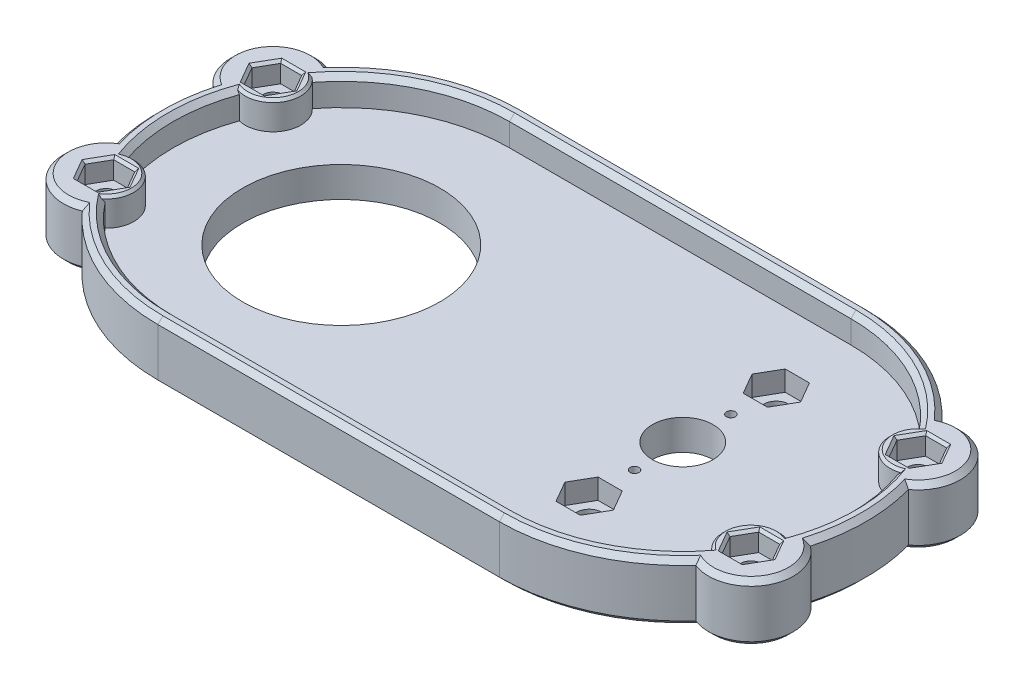
from build123d import *

# Parameters (mm, degrees)
SKETCH1_R               = 19.5
SKETCH1_R_2             = 6
SKETCH1_R_3             = 2.5
SKETCH1_R_4             = 2
BOSS_EXTRUDE1_DEPTH     = 6
SKETCH5_R               = 2
BOSS_EXTRUDE2_DEPTH     = 5.5
CUT_EXTRUDE2_DEPTH      = 4
CHAMFER1_SIZE           = 1
CHAMFER2_SIZE           = 0.5
CUT_EXTRUDE3_DEPTH      = 113.093142074
CUT_EXTRUDE3_DEPTH_BACK = 113.093142074
SKETCH8_R               = 0.875
CUT_EXTRUDE4_DEPTH      = 4


with BuildPart() as part:
    # Sketch1 → Boss-Extrude1 (new body)
    with BuildSketch(Plane(origin=(0, 0, 0), x_dir=(1, 0, 0), z_dir=(0, 1, 0))):
        with BuildLine():
            Line((0, 36.25), (67.5, 36.25))
            ThreePointArc((67.5, 36.25), (82.21405629, 33.129428723), (94.394801605, 24.30498193))
            ThreePointArc((94.394801605, 24.30498193), (104.860213633, 20.548117498), (102.428678881, 9.697932337))
            ThreePointArc((102.428678881, 9.697932337), (103.75, 0), (102.428678881, -9.697932337))
            ThreePointArc((102.428678881, -9.697932337), (104.860213633, -20.548117498), (94.394801605, -24.30498193))
            ThreePointArc((94.394801605, -24.30498193), (82.21405629, -33.129428723), (67.5, -36.25))
            Line((67.5, -36.25), (0, -36.25))
            ThreePointArc((0, -36.25), (-14.71405629, -33.129428723), (-26.894801605, -24.30498193))
            ThreePointArc((-26.894801605, -24.30498193), (-37.360213633, -20.548117498), (-34.928678881, -9.697932337))
            ThreePointArc((-34.928678881, -9.697932337), (-36.25, 0), (-34.928678881, 9.697932337))
            ThreePointArc((-34.928678881, 9.697932337), (-37.360213633, 20.548117498), (-26.894801605, 24.30498193))
            ThreePointArc((-26.894801605, 24.30498193), (-14.71405629, 33.129428723), (0, 36.25))
        make_face()
        with Locations(Location((0, 0, 0), (0, 0, 270))):
            Circle(SKETCH1_R, mode=Mode.SUBTRACT)
        with Locations(Location((67.5, 0, 0), (0, 0, 270))):
            Circle(SKETCH1_R_2, mode=Mode.SUBTRACT)
        with Locations(Location((67.5, 18.5, 0), (0, 0, 270))):
            Circle(SKETCH1_R_3, mode=Mode.SUBTRACT)
        with Locations(Location((67.5, -18.5, 0), (0, 0, 270))):
            Circle(SKETCH1_R_3, mode=Mode.SUBTRACT)
        with Locations(Location((-30, 16.5, 0), (0, 0, 270))):
            Circle(SKETCH1_R_4, mode=Mode.SUBTRACT)
        with Locations(Location((-30, -16.5, 0), (0, 0, 270))):
            Circle(SKETCH1_R_4, mode=Mode.SUBTRACT)
        with Locations(Location((97.5, -16.5, 0), (0, 0, 270))):
            Circle(SKETCH1_R_4, mode=Mode.SUBTRACT)
        with Locations(Location((97.5, 16.5, 0), (0, 0, 270))):
            Circle(SKETCH1_R_4, mode=Mode.SUBTRACT)
    extrude(amount=BOSS_EXTRUDE1_DEPTH)

    # Sketch5 → Boss-Extrude2 (add)
    with BuildSketch(Plane(origin=(0, 6, 0), x_dir=(1, 0, 0), z_dir=(0, 1, 0))):
        with BuildLine():
            Line((0, 36.25), (67.5, 36.25))
            ThreePointArc((67.5, 36.25), (82.21405629, 33.129428723), (94.394801605, 24.30498193))
            ThreePointArc((94.394801605, 24.30498193), (104.860213633, 20.548117498), (102.428678881, 9.697932337))
            ThreePointArc((102.428678881, 9.697932337), (103.75, 0), (102.428678881, -9.697932337))
            ThreePointArc((102.428678881, -9.697932337), (104.860213633, -20.548117498), (94.394801605, -24.30498193))
            ThreePointArc((94.394801605, -24.30498193), (82.21405629, -33.129428723), (67.5, -36.25))
            Line((67.5, -36.25), (0, -36.25))
            ThreePointArc((0, -36.25), (-14.71405629, -33.129428723), (-26.894801605, -24.30498193))
            ThreePointArc((-26.894801605, -24.30498193), (-37.360213633, -20.548117498), (-34.928678881, -9.697932337))
            ThreePointArc((-34.928678881, -9.697932337), (-36.25, 0), (-34.928678881, 9.697932337))
            ThreePointArc((-34.928678881, 9.697932337), (-37.360213633, 20.548117498), (-26.894801605, 24.30498193))
            ThreePointArc((-26.894801605, 24.30498193), (-14.71405629, 33.129428723), (0, 36.25))
        make_face()
        with Locations(Location((-30, 16.5, 0), (0, 0, 270))):
            Circle(SKETCH5_R, mode=Mode.SUBTRACT)
        with Locations(Location((97.5, 16.5, 0), (0, 0, 270))):
            Circle(SKETCH5_R, mode=Mode.SUBTRACT)
        with Locations(Location((97.5, -16.5, 0), (0, 0, 270))):
            Circle(SKETCH5_R, mode=Mode.SUBTRACT)
        with Locations(Location((-30, -16.5, 0), (0, 0, 270))):
            Circle(SKETCH5_R, mode=Mode.SUBTRACT)
        with BuildLine():
            Line((0, 33.25), (67.5, 33.25))
            ThreePointArc((67.5, 33.25), (82.073642664, 29.885973959), (93.698346174, 20.474597865))
            ThreePointArc((93.698346174, 20.474597865), (92.680812502, 13.849446876), (98.820847684, 11.160958757))
            ThreePointArc((98.820847684, 11.160958757), (100.75, 0), (98.820847684, -11.160958757))
            ThreePointArc((98.820847684, -11.160958757), (92.680812502, -13.849446876), (93.698346174, -20.474597865))
            ThreePointArc((93.698346174, -20.474597865), (82.073642664, -29.885973959), (67.5, -33.25))
            Line((67.5, -33.25), (0, -33.25))
            ThreePointArc((0, -33.25), (-14.573642664, -29.885973959), (-26.198346174, -20.474597865))
            ThreePointArc((-26.198346174, -20.474597865), (-25.180812502, -13.849446876), (-31.320847684, -11.160958757))
            ThreePointArc((-31.320847684, -11.160958757), (-33.25, 0), (-31.320847684, 11.160958757))
            ThreePointArc((-31.320847684, 11.160958757), (-25.180812502, 13.849446876), (-26.198346174, 20.474597865))
            ThreePointArc((-26.198346174, 20.474597865), (-14.573642664, 29.885973959), (0, 33.25))
        make_face(mode=Mode.SUBTRACT)
    extrude(amount=BOSS_EXTRUDE2_DEPTH)

    # Sketch6 → Cut-Extrude2 (cut)
    with BuildSketch(Plane(origin=(0, 11.5, 0), x_dir=(1, 0, 0), z_dir=(0, 1, 0))):
        Polygon((-25.843078062, 16.5), (-27.921539031, 20.1), (-32.078460969, 20.1), (-34.156921938, 16.5), (-32.078460969, 12.9), (-27.921539031, 12.9), align=None)
        Polygon((-34.156921938, -16.5), (-32.078460969, -20.1), (-27.921539031, -20.1), (-25.843078062, -16.5), (-27.921539031, -12.9), (-32.078460969, -12.9), align=None)
        Polygon((101.656921938, 16.5), (99.578460969, 20.1), (95.421539031, 20.1), (93.343078062, 16.5), (95.421539031, 12.9), (99.578460969, 12.9), align=None)
        Polygon((99.578460969, -20.1), (101.656921938, -16.5), (99.578460969, -12.9), (95.421539031, -12.9), (93.343078062, -16.5), (95.421539031, -20.1), align=None)
    extrude(amount=-CUT_EXTRUDE2_DEPTH, mode=Mode.SUBTRACT)

    # Chamfer1
    chamfer1_edges = [part.edges().sort_by_distance(p)[0] for p in [
        (-14.71405629, 0, -33.129428723),
        (33.75, 0, -36.25),
        (82.21405629, 0, -33.129428723),
        (104.860213633, 0, -20.548117498),
        (103.75, 0, 0),
        (104.860213633, 0, 20.548117498),
        (82.21405629, 0, 33.129428723),
        (33.75, 0, 36.25),
        (-14.71405629, 0, 33.129428723),
        (-37.360213633, 0, 20.548117498),
        (-36.25, 0, 0),
        (-37.360213633, 0, -20.548117498),
        (-14.71405629, 11.5, 33.129428723),
        (33.75, 11.5, 36.25),
        (82.21405629, 11.5, 33.129428723),
        (104.860213633, 11.5, 20.548117498),
        (103.75, 11.5, 0),
        (104.860213633, 11.5, -20.548117498),
        (82.21405629, 11.5, -33.129428723),
        (33.75, 11.5, -36.25),
        (-14.71405629, 11.5, -33.129428723),
        (-37.360213633, 11.5, -20.548117498),
        (-36.25, 11.5, 0),
        (-37.360213633, 11.5, 20.548117498),
        (100.75, 11.5, 0),
        (82.073642664, 11.5, -29.885973959),
        (33.75, 11.5, -33.25),
        (-14.573642664, 11.5, -29.885973959),
        (-33.25, 11.5, 0),
        (-14.573642664, 11.5, 29.885973959),
        (33.75, 11.5, 33.25),
        (82.073642664, 11.5, 29.885973959),
    ]]
    chamfer(chamfer1_edges, length=CHAMFER1_SIZE)

    # Chamfer2
    chamfer2_edges = [part.edges().sort_by_distance(p)[0] for p in [
        (-30, 11.5, -12.9),
        (-33.117691454, 11.5, -14.7),
        (-33.117691454, 11.5, -18.3),
        (-30, 11.5, -20.1),
        (-26.882308546, 11.5, -14.7),
        (-26.882308546, 11.5, -18.3),
        (-25.180812502, 11.5, -13.849446876),
        (-30, 11.5, 20.1),
        (-33.117691454, 11.5, 18.3),
        (-33.117691454, 11.5, 14.7),
        (-30, 11.5, 12.9),
        (-26.882308546, 11.5, 18.3),
        (-26.882308546, 11.5, 14.7),
        (-25.180812502, 11.5, 13.849446876),
        (100.617691454, 11.5, 18.3),
        (97.5, 11.5, 20.1),
        (94.382308546, 11.5, 18.3),
        (94.382308546, 11.5, 14.7),
        (97.5, 11.5, 12.9),
        (100.617691454, 11.5, 14.7),
        (92.680812502, 11.5, 13.849446876),
        (92.680812502, 11.5, -13.849446876),
        (97.5, 11.5, -12.9),
        (94.382308546, 11.5, -14.7),
        (94.382308546, 11.5, -18.3),
        (97.5, 11.5, -20.1),
        (100.617691454, 11.5, -14.7),
        (100.617691454, 11.5, -18.3),
    ]]
    chamfer(chamfer2_edges, length=CHAMFER2_SIZE)

    # Sketch8 → Cut-Extrude3 (cut, two sides: drawn at the far end of the back side and taken through both)
    with BuildSketch(Plane(origin=(0, 6, 0), x_dir=(1, 0, 0), z_dir=(0, 1, 0)).offset(-CUT_EXTRUDE3_DEPTH_BACK)):
        with Locations(Location((67.5, 9.525, 0), (0, 0, 270))):
            Circle(SKETCH8_R)
        with Locations(Location((67.5, -9.525, 0), (0, 0, 270))):
            Circle(SKETCH8_R)
    extrude(amount=CUT_EXTRUDE3_DEPTH + CUT_EXTRUDE3_DEPTH_BACK, mode=Mode.SUBTRACT)

    # Sketch9 → Cut-Extrude4 (cut)
    with BuildSketch(Plane(origin=(0, 6, 0), x_dir=(1, 0, 0), z_dir=(0, 1, 0))):
        Polygon((72.292007234, 18.5), (69.896003617, 22.65), (65.103996383, 22.65), (62.707992766, 18.5), (65.103996383, 14.35), (69.896003617, 14.35), align=None)
        Polygon((72.292007234, -18.5), (69.896003617, -14.35), (65.103996383, -14.35), (62.707992766, -18.5), (65.103996383, -22.65), (69.896003617, -22.65), align=None)
    extrude(amount=-CUT_EXTRUDE4_DEPTH, mode=Mode.SUBTRACT)


solid = part.part
